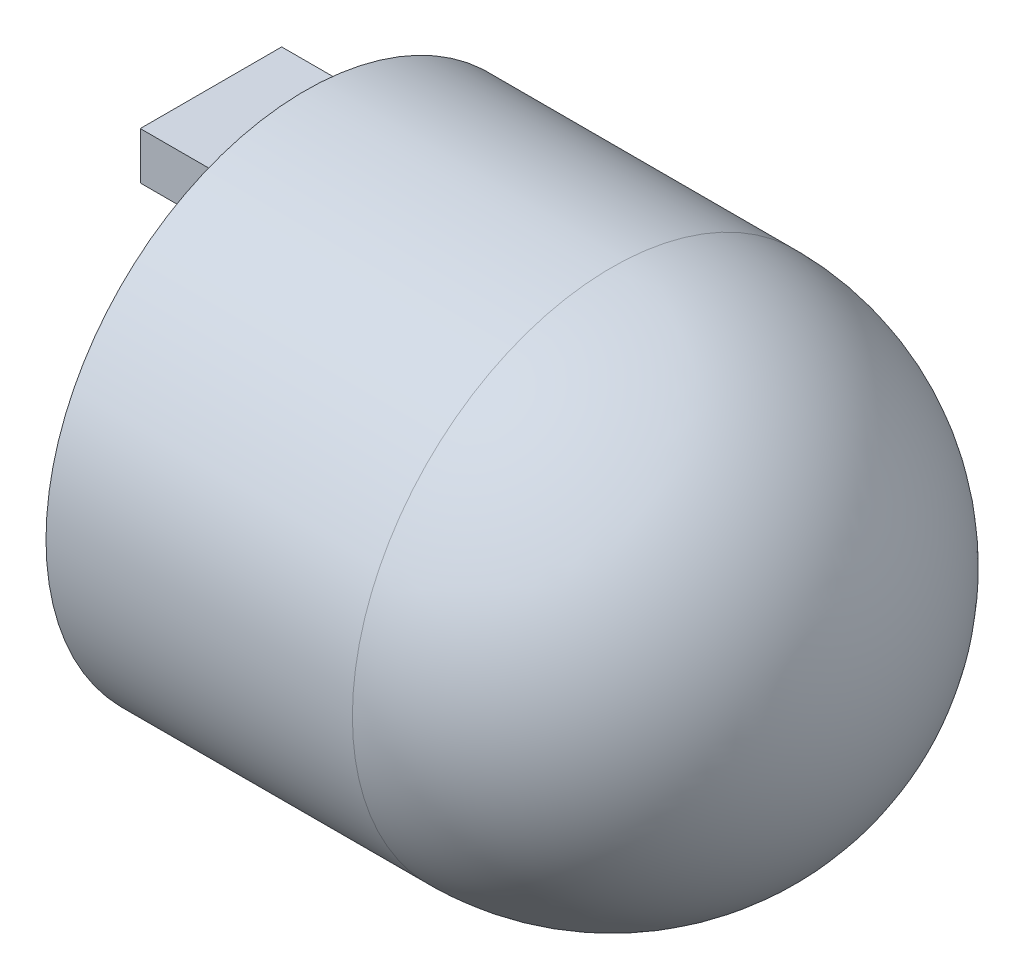
from build123d import *

# Parameters (mm, degrees)
CUT_EXTRUDE1_DEPTH  = 2.75
SKETCH5_W           = 3
SKETCH5_H           = 1
BOSS_EXTRUDE2_DEPTH = 2


with BuildPart() as part:
    # Sketch1 → Revolve1 (revolve)
    with BuildSketch(Plane.XY, mode=Mode.PRIVATE) as revolve1_sk:
        with BuildLine():
            Line((0, 0), (12, 0))
            ThreePointArc((12, 0), (10.389087297, -3.889087297), (6.5, -5.5))
            Line((6.5, -5.5), (0, -5.5))
            Line((0, -5.5), (0, 0))
        make_face()
    revolve(revolve1_sk.sketch.rotate(Axis((0, 0, 0), (1, 0, 0)), 270), axis=Axis((0, 0, 0), (1, 0, 0)))

    # Sketch2 → Cut-Extrude1 (cut)
    with BuildSketch(Plane.ZY):
        Polygon((2.050748156, 3.552), (-2.050748156, 3.552), (-4.101496312, 0), (-2.050748156, -3.552), (2.050748156, -3.552), (4.101496312, 0), align=None)
    extrude(amount=-CUT_EXTRUDE1_DEPTH, mode=Mode.SUBTRACT)

    # Sketch5 → Boss-Extrude2 (add)
    with BuildSketch(Plane.ZY):
        with Locations((0, 4.052)):
            Rectangle(SKETCH5_W, SKETCH5_H)
        with Locations((0, -4.052)):
            Rectangle(SKETCH5_W, SKETCH5_H)
    extrude(amount=BOSS_EXTRUDE2_DEPTH)


solid = part.part
